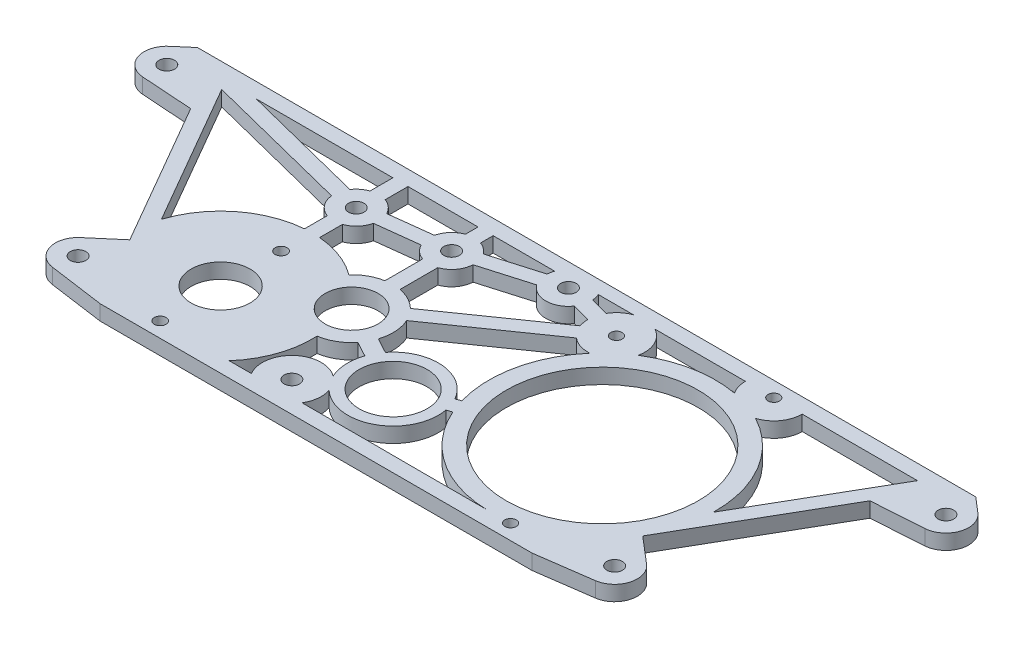
from build123d import *

# Parameters (mm, degrees)
SKETCH1_R           = 12.3825
SKETCH1_R_2         = 2.4892
SKETCH1_R_3         = 11.1252
SKETCH1_R_4         = 14.3002
SKETCH1_R_5         = 2.413
SKETCH1_R_6         = 40.3225
SKETCH1_R_7         = 3.2639
BOSS_EXTRUDE1_DEPTH = 6.35
SKETCH3_R           = 3.2639
SKETCH3_R_2         = 3.258583446
CUT_EXTRUDE2_DEPTH  = 233.226149567


with BuildPart() as part:
    # Sketch1 → Boss-Extrude1 (new body)
    with BuildSketch(Plane(origin=(0, 0, 0), x_dir=(1, 0, 0), z_dir=(0, 1, 0))):
        Polygon((-155.087712155, 84.29625), (-89.463193808, -29.36875), (150.668810904, -29.36875), (216.293329251, 84.29625), align=None)
        with Locations(Location((-41.275, 2.38125, 0), (0, 0, 270))):
            Circle(SKETCH1_R, mode=Mode.SUBTRACT)
        with Locations(Location((-41.275, 27.78125, 0), (0, 0, 270))):
            Circle(SKETCH1_R_2, mode=Mode.SUBTRACT)
        with Locations(Location((-41.275, -23.01875, 0), (0, 0, 270))):
            Circle(SKETCH1_R_2, mode=Mode.SUBTRACT)
        with Locations(Location((-5.496024757, 21.654924548, 0), (0, 0, 270))):
            Circle(SKETCH1_R_3, mode=Mode.SUBTRACT)
        with Locations(Location((32.48383617, 1.11125, 0), (0, 0, 270))):
            Circle(SKETCH1_R_4, mode=Mode.SUBTRACT)
        with Locations(Location((60.01758652, 67.406835627, 0), (0, 0, 270))):
            Circle(SKETCH1_R_5, mode=Mode.SUBTRACT)
        with Locations(Location((115.607306669, 77.94625, 0), (0, 0, 270))):
            Circle(SKETCH1_R_5, mode=Mode.SUBTRACT)
        with Locations(Location((105.955591438, -23.01875, 0), (0, 0, 270))):
            Circle(SKETCH1_R_5, mode=Mode.SUBTRACT)
        with Locations(Location((96.939901816, 24.534144815, 0), (0, 0, 270))):
            Circle(SKETCH1_R_6, mode=Mode.SUBTRACT)
        with Locations(Location((-133.090666899, 71.59625, 0), (0, 0, 270))):
            Circle(SKETCH1_R_7, mode=Mode.SUBTRACT)
        with Locations(Location((-82.130845389, -16.66875, 0), (0, 0, 270))):
            Circle(SKETCH1_R_7, mode=Mode.SUBTRACT)
        with Locations(Location((194.296283995, 71.59625, 0), (0, 0, 270))):
            Circle(SKETCH1_R_7, mode=Mode.SUBTRACT)
        with Locations(Location((143.336462485, -16.66875, 0), (0, 0, 270))):
            Circle(SKETCH1_R_7, mode=Mode.SUBTRACT)
    extrude(amount=BOSS_EXTRUDE1_DEPTH)

    # Sketch3 → Cut-Extrude2 (cut, through all)
    with BuildSketch(Plane(origin=(0, 6.35, 0), x_dir=(1, 0, 0), z_dir=(0, 1, 0))):
        with BuildLine():
            Line((216.293329251, 84.29625), (194.094002759, 84.29625))
            Line((194.094002759, 84.29625), (200.482952973, 78.838539138))
            ThreePointArc((200.482952973, 78.838539138), (203.338674486, 68.602790594), (194.939381575, 62.092984745))
            Line((194.939381575, 62.092984745), (173.299400368, 60.628580757))
            Line((173.299400368, 60.628580757), (138.359146632, 0.110286058))
            Line((138.359146632, 0.110286058), (149.523131463, -9.426460862))
            ThreePointArc((149.523131463, -9.426460862), (152.480247084, -19.336488408), (144.658083658, -26.101615019))
            Line((144.658083658, -26.101615019), (121.339417229, -29.36875))
            Line((121.339417229, -29.36875), (150.668810904, -29.36875))
            Line((150.668810904, -29.36875), (216.293329251, 84.29625))
        make_face()
        with BuildLine():
            Line((-139.277335877, 78.838539138), (-132.888385663, 84.29625))
            Line((-132.888385663, 84.29625), (-155.087712155, 84.29625))
            Line((-155.087712155, 84.29625), (-89.463193808, -29.36875))
            Line((-89.463193808, -29.36875), (-60.133800133, -29.36875))
            Line((-60.133800133, -29.36875), (-83.452466562, -26.101615019))
            ThreePointArc((-83.452466562, -26.101615019), (-91.274629988, -19.336488408), (-88.317514367, -9.426460862))
            Line((-88.317514367, -9.426460862), (-77.153529536, 0.110286058))
            Line((-77.153529536, 0.110286058), (-112.093783272, 60.628580757))
            Line((-112.093783272, 60.628580757), (-133.733764479, 62.092984745))
            ThreePointArc((-133.733764479, 62.092984745), (-142.13305739, 68.602790594), (-139.277335877, 78.838539138))
        make_face()
        with BuildLine():
            Line((47.814092291, -23.01875), (68.181438384, -23.083024918))
            Line((68.181438384, -23.083024918), (96.076321123, -23.083024918))
            ThreePointArc((96.076321123, -23.083024918), (70.568830934, -15.123228341), (53.3627184, 5.320355219))
            Line((53.3627184, 5.320355219), (51.222267729, 4.542530038))
            ThreePointArc((51.222267729, 4.542530038), (41.625748882, -15.601856592), (19.486846811, -12.816447857))
            ThreePointArc((19.486846811, -12.816447857), (20.025058188, -18.04104949), (18.349161012, -23.01875))
            Line((18.349161012, -23.01875), (47.814092291, -23.01875))
        make_face()
        with BuildLine():
            ThreePointArc((65.624420624, 77.94625), (70.839432321, 72.447023863), (71.692940222, 64.916462174))
            ThreePointArc((71.692940222, 64.916462174), (88.068575871, 71.325599173), (105.653728832, 71.355185424))
            ThreePointArc((105.653728832, 71.355185424), (104.176172512, 74.504591113), (103.669306669, 77.94625))
            Line((103.669306669, 77.94625), (65.624420624, 77.94625))
        make_face()
        with BuildLine():
            Line((49.053481172, 10.510684265), (51.193931844, 11.288509446))
            ThreePointArc((51.193931844, 11.288509446), (50.390005045, 34.596338197), (60.748765196, 55.491248283))
            ThreePointArc((60.748765196, 55.491248283), (56.315080015, 56.057505709), (52.400421048, 58.214739339))
            Line((52.400421048, 58.214739339), (10.400093309, 28.883502325))
            ThreePointArc((10.400093309, 28.883502325), (11.938221759, 22.647877037), (11.11803249, 16.277935796))
            Line((11.11803249, 16.277935796), (17.472938166, 12.840505779))
            ThreePointArc((17.472938166, 12.840505779), (33.885421031, 20.109619927), (49.053481172, 10.510684265))
        make_face()
        with BuildLine():
            Line((-12.26642072, -23.01875), (-2.911488672, -23.01875))
            ThreePointArc((-2.911488672, -23.01875), (-0.572987431, -7.472448155), (15.13161349, -6.750230017))
            ThreePointArc((15.13161349, -6.750230017), (13.456237349, 0.187679153), (14.451809556, 7.255232113))
            Line((14.451809556, 7.255232113), (8.09690388, 10.69266213))
            ThreePointArc((8.09690388, 10.69266213), (3.247440056, 6.539014741), (-2.771017966, 4.40635231))
            ThreePointArc((-2.771017966, 4.40635231), (-4.839844683, -10.233706554), (-12.26642072, -23.01875))
        make_face()
        with BuildLine():
            Line((-50.759436627, 58.498761805), (-112.546125373, 74.112060259))
            Line((-112.546125373, 74.112060259), (-77.968891343, 14.222534134))
            ThreePointArc((-77.968891343, 14.222534134), (-65.234805689, 32.590278174), (-44.45, 40.807504655))
            Line((-44.45, 40.807504655), (-44.45, 50.396621207))
            ThreePointArc((-44.45, 50.396621207), (-48.790085129, 53.524602513), (-50.759436627, 58.498761805))
        make_face()
        with BuildLine():
            Line((-44.45, 77.94625), (-101.800382387, 77.94625))
            Line((-101.800382387, 77.94625), (-49.203714213, 64.655240325))
            ThreePointArc((-49.203714213, 64.655240325), (-47.127274815, 66.891962457), (-44.45, 68.357133449))
            Line((-44.45, 68.357133449), (-44.45, 77.94625))
        make_face()
        with BuildLine():
            Line((175.965412948, 77.94625), (127.545306669, 77.94625))
            ThreePointArc((127.545306669, 77.94625), (125.262868019, 70.925852645), (119.288315712, 66.58992945))
            ThreePointArc((119.288315712, 66.58992945), (138.013120037, 48.640811318), (144.554546133, 23.541032766))
            Line((144.554546133, 23.541032766), (175.965412948, 77.94625))
        make_face()
        with BuildLine():
            Line((-8.671024757, 77.94625), (-38.1, 77.94625))
            Line((-38.1, 77.94625), (-38.1, 68.357133449))
            ThreePointArc((-38.1, 68.357133449), (-34.952622948, 66.501003479), (-32.735648144, 63.596485707))
            Line((-32.735648144, 63.596485707), (-14.789932822, 65.744151131))
            ThreePointArc((-14.789932822, 65.744151131), (-12.620150909, 69.981127052), (-8.671024757, 72.639006121))
            Line((-8.671024757, 72.639006121), (-8.671024757, 77.94625))
        make_face()
        with BuildLine():
            Line((23.503580049, 77.94625), (-2.321024757, 77.94625))
            Line((-2.321024757, 77.94625), (-2.321024757, 72.639006121))
            ThreePointArc((-2.321024757, 72.639006121), (0.215735977, 71.281178374), (2.231289861, 69.227792449))
            Line((2.231289861, 69.227792449), (22.973340196, 75.296693933))
            ThreePointArc((22.973340196, 75.296693933), (23.144028083, 76.640370087), (23.503580049, 77.94625))
        make_face()
        with BuildLine():
            Line((6.76434919, 34.08963954), (48.764676929, 63.420876554))
            ThreePointArc((48.764676929, 63.420876554), (48.260129345, 65.338492141), (48.079953972, 67.313170504))
            Line((48.079953972, 67.313170504), (40.338763738, 69.383696019))
            ThreePointArc((40.338763738, 69.383696019), (32.5947676, 65.246895995), (24.756521552, 69.202207551))
            Line((24.756521552, 69.202207551), (4.014471217, 63.133306067))
            ThreePointArc((4.014471217, 63.133306067), (2.126403616, 57.946989266), (-2.321024757, 54.678493879))
            Line((-2.321024757, 54.678493879), (-2.321024757, 38.826362497))
            ThreePointArc((-2.321024757, 38.826362497), (2.576882297, 37.139338581), (6.76434919, 34.08963954))
        make_face()
        with BuildLine():
            Line((-14.035376613, 59.43914162), (-31.981091935, 57.291476197))
            ThreePointArc((-31.981091935, 57.291476197), (-34.150873849, 53.054500276), (-38.1, 50.396621207))
            Line((-38.1, 50.396621207), (-38.1, 40.807504655))
            ThreePointArc((-38.1, 40.807504655), (-27.736533159, 38.483432585), (-18.400321213, 33.420044149))
            ThreePointArc((-18.400321213, 33.420044149), (-13.977947484, 36.919127544), (-8.671024757, 38.826362497))
            Line((-8.671024757, 38.826362497), (-8.671024757, 54.678493879))
            ThreePointArc((-8.671024757, 54.678493879), (-11.818401809, 56.534623849), (-14.035376613, 59.43914162))
        make_face()
        with BuildLine():
            ThreePointArc((41.196515027, 78.620256643), (41.719201203, 77.102270743), (41.979514016, 75.518061392))
            Line((41.979514016, 75.518061392), (49.720704249, 73.447535877))
            ThreePointArc((49.720704249, 73.447535877), (52.370619317, 76.57415457), (55.921852993, 78.620256643))
            Line((55.921852993, 78.620256643), (41.196515027, 78.620256643))
        make_face()
        with Locations(Location((-5.496024757, 63.65875, 0), (0, 0, 270))):
            Circle(SKETCH3_R)
        with Locations(Location((-41.275, 59.376877328, 0), (0, 0, 270))):
            Circle(SKETCH3_R)
        with Locations(Location((7.71883617, -16.66875, 0), (0, 0, 270))):
            Circle(SKETCH3_R_2)
        with Locations(Location((32.48383617, 74.77125, 0), (0, 0, 270))):
            Circle(SKETCH3_R)
    extrude(amount=-CUT_EXTRUDE2_DEPTH, mode=Mode.SUBTRACT)


solid = part.part
